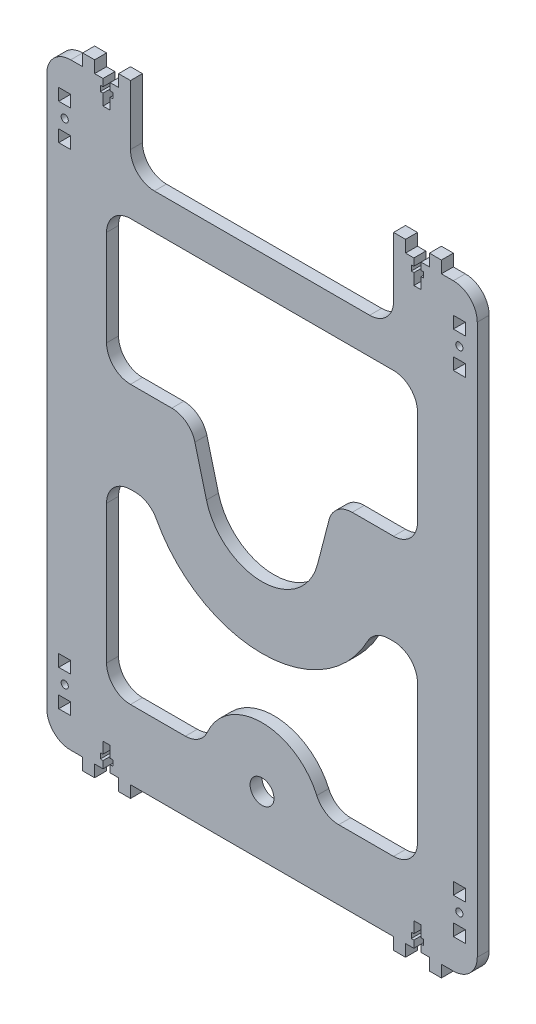
from build123d import *

# Parameters (mm, degrees)
SKETCH1_W           = 5
SKETCH1_H           = 5
SKETCH1_R           = 1.5
SKETCH1_R_2         = 5
BOSS_EXTRUDE1_DEPTH = 5
FILLET1_R           = 10


with BuildPart() as part:
    # Sketch1 → Boss-Extrude1 (new body)
    with BuildSketch(Plane.XY):
        Polygon((-75, 125), (-90, 125), (-90, -125), (-75, -125), (-75, -130), (-70, -130), (-70, -125), (-66.5, -125), (-66.5, -122), (-67.6, -122), (-67.6, -119.7), (-66.5, -119.7), (-66.5, -115), (-63.5, -115), (-63.5, -119.7), (-62.4, -119.7), (-62.4, -122), (-63.5, -122), (-63.5, -125), (-60, -125), (-60, -130), (-55, -130), (-55, -125), (55, -125), (55, -130), (60, -130), (60, -125), (63.5, -125), (63.5, -122), (62.4, -122), (62.4, -119.7), (63.5, -119.7), (63.5, -115), (66.5, -115), (66.5, -119.7), (67.6, -119.7), (67.6, -122), (66.5, -122), (66.5, -125), (70, -125), (70, -130), (75, -130), (75, -125), (90, -125), (90, 125), (75, 125), (75, 130), (70, 130), (70, 125), (66.5, 125), (66.5, 122), (67.6, 122), (67.6, 119.7), (66.5, 119.7), (66.5, 115), (63.5, 115), (63.5, 119.7), (62.4, 119.7), (62.4, 122), (63.5, 122), (63.5, 125), (60, 125), (60, 130), (55, 130), (55, 95), (-55, 95), (-55, 130), (-60, 130), (-60, 125), (-63.5, 125), (-63.5, 122), (-62.4, 122), (-62.4, 119.7), (-63.5, 119.7), (-63.5, 115), (-66.5, 115), (-66.5, 119.7), (-67.6, 119.7), (-67.6, 122), (-66.5, 122), (-66.5, 125), (-70, 125), (-70, 130), (-75, 130), align=None)
        with Locations((-82.5, -110)):
            Rectangle(SKETCH1_W, SKETCH1_H, mode=Mode.SUBTRACT)
        with Locations((-82.5, -102.5)):
            Circle(SKETCH1_R, mode=Mode.SUBTRACT)
        with Locations((-82.5, -95)):
            Rectangle(SKETCH1_W, SKETCH1_H, mode=Mode.SUBTRACT)
        with Locations((0, -100)):
            Circle(SKETCH1_R_2, mode=Mode.SUBTRACT)
        with Locations((82.5, -110)):
            Rectangle(SKETCH1_W, SKETCH1_H, mode=Mode.SUBTRACT)
        with Locations((82.5, -102.5)):
            Circle(SKETCH1_R, mode=Mode.SUBTRACT)
        with Locations((82.5, -95)):
            Rectangle(SKETCH1_W, SKETCH1_H, mode=Mode.SUBTRACT)
        with BuildLine():
            Line((-65, -18.081635275), (-46.616032283, -18.081635275))
            ThreePointArc((-46.616032283, -18.081635275), (0, -50), (46.616032283, -18.081635275))
            Line((46.616032283, -18.081635275), (65, -18.081635275))
            Line((65, -18.081635275), (65, -95.958016924))
            Line((65, -95.958016924), (24.671083738, -95.958016924))
            ThreePointArc((24.671083738, -95.958016924), (0, -75), (-24.671083738, -95.958016924))
            Line((-24.671083738, -95.958016924), (-65, -95.958016924))
            Line((-65, -95.958016924), (-65, -18.081635275))
        make_face(mode=Mode.SUBTRACT)
        with Locations((-82.5, 95)):
            Rectangle(SKETCH1_W, SKETCH1_H, mode=Mode.SUBTRACT)
        with Locations((-82.5, 102.5)):
            Circle(SKETCH1_R, mode=Mode.SUBTRACT)
        with Locations((-82.5, 110)):
            Rectangle(SKETCH1_W, SKETCH1_H, mode=Mode.SUBTRACT)
        with BuildLine():
            ThreePointArc((23.227291604, -6.040937406), (0, -24), (-23.227291604, -6.040937406))
            Line((-23.227291604, -6.040937406), (-30, 20))
            Line((-30, 20), (-65, 20))
            Line((-65, 20), (-65, 80))
            Line((-65, 80), (65, 80))
            Line((65, 80), (65, 20))
            Line((65, 20), (30, 20))
            Line((30, 20), (23.227291604, -6.040937406))
        make_face(mode=Mode.SUBTRACT)
        with Locations((82.5, 95)):
            Rectangle(SKETCH1_W, SKETCH1_H, mode=Mode.SUBTRACT)
        with Locations((82.5, 102.5)):
            Circle(SKETCH1_R, mode=Mode.SUBTRACT)
        with Locations((82.5, 110)):
            Rectangle(SKETCH1_W, SKETCH1_H, mode=Mode.SUBTRACT)
    extrude(amount=BOSS_EXTRUDE1_DEPTH)

    # Fillet1
    fillet1_edges = [part.edges().sort_by_distance(p)[0] for p in [
        (-65, -18.081635275, 2.5),
        (-65, -95.958016924, 2.5),
        (-24.671083738, -95.958016924, 2.5),
        (24.671083738, -95.958016924, 2.5),
        (65, -95.958016924, 2.5),
        (65, -18.081635275, 2.5),
        (46.616032283, -18.081635275, 2.5),
        (-46.616032283, -18.081635275, 2.5),
        (30, 20, 2.5),
        (65, 20, 2.5),
        (65, 80, 2.5),
        (-65, 80, 2.5),
        (-65, 20, 2.5),
        (-30, 20, 2.5),
        (-55, 95, 2.5),
        (55, 95, 2.5),
        (90, 125, 2.5),
        (90, -125, 2.5),
        (-90, -125, 2.5),
        (-90, 125, 2.5),
    ]]
    fillet(fillet1_edges, radius=FILLET1_R)


solid = part.part
